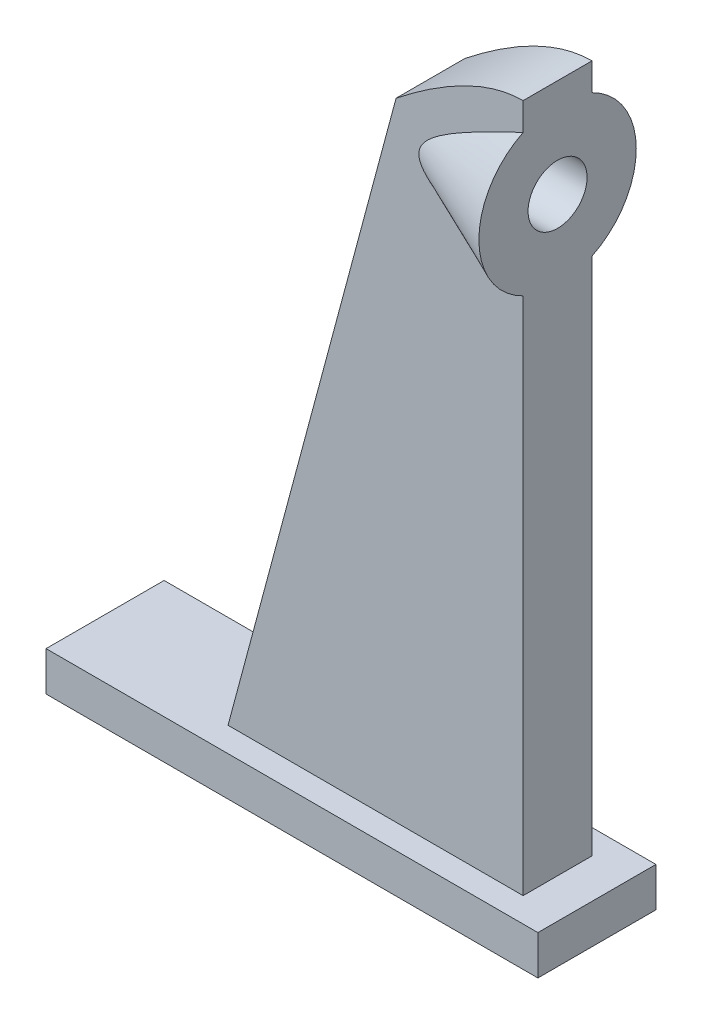
from build123d import *

# Parameters (mm, degrees)
SKETCH1_W                = 250
SKETCH1_H                = 60
BOSS_EXTRUDE1_DEPTH      = 20
BOSS_EXTRUDE3_DEPTH      = 17.5
BOSS_EXTRUDE3_DEPTH_BACK = 17.5
SKETCH4_R                = 40
BOSS_EXTRUDE5_DEPTH      = 80
BOSS_EXTRUDE5_DRAFT      = -23
SKETCH4_4_R              = 15
CUT_EXTRUDE3_DEPTH       = 168


with BuildPart() as part:
    # Sketch1 → Boss-Extrude1 (new body)
    with BuildSketch(Plane(origin=(0, 0, 0), x_dir=(1, 0, 0), z_dir=(0, 1, 0))):
        Rectangle(SKETCH1_W, SKETCH1_H)
    extrude(amount=BOSS_EXTRUDE1_DEPTH)

    # Sketch3 → Boss-Extrude3 (add, two sides: drawn at the far end of the back side and taken through both)
    with BuildSketch(Plane.XY.offset(-BOSS_EXTRUDE3_DEPTH_BACK)):
        with BuildLine():
            Line((105, 20), (-45, 20))
            Line((-45, 20), (40.410284884, 338.755522675))
            add(Edge.make_bspline(
                [(40.410284884, 338.755522675), (80, 370), (105, 370)],
                knots=[0, 0, 0, 1, 1, 1], degree=2))
            Line((105, 370), (105, 20))
        make_face()
    extrude(amount=BOSS_EXTRUDE3_DEPTH + BOSS_EXTRUDE3_DEPTH_BACK)


with BuildPart() as boss_extrude5_tool:
    # Sketch4 → Boss-Extrude5 (with draft: the straight prism first)
    with BuildSketch(Plane(origin=(105, 0, 0), x_dir=(0, 0, -1), z_dir=(1, 0, 0))):
        with Locations((0, 320)):
            Circle(SKETCH4_R)
    extrude(amount=-BOSS_EXTRUDE5_DEPTH)
    # Boss-Extrude5: the draft: its side faces are tilted about the plane it starts from
    boss_extrude5_sides = [boss_extrude5_tool.faces().sort_by_distance(p)[0] for p in [
        (65, 320, 40),
    ]]
    draft(boss_extrude5_sides, Plane(origin=(105, 0, 0), x_dir=(0, 0, -1), z_dir=(1, 0, 0)), BOSS_EXTRUDE5_DRAFT)


with BuildPart() as part_1:
    add(part.part)

    # Boss-Extrude5: add boss_extrude5_tool
    add(boss_extrude5_tool.part)

    # Sketch4<4> → Cut-Extrude3 (cut)
    with BuildSketch(Plane(origin=(105, 0, 0), x_dir=(0, 0, -1), z_dir=(1, 0, 0))):
        with Locations((0, 320)):
            Circle(SKETCH4_4_R)
    extrude(amount=-CUT_EXTRUDE3_DEPTH, mode=Mode.SUBTRACT)


solid = part_1.part
